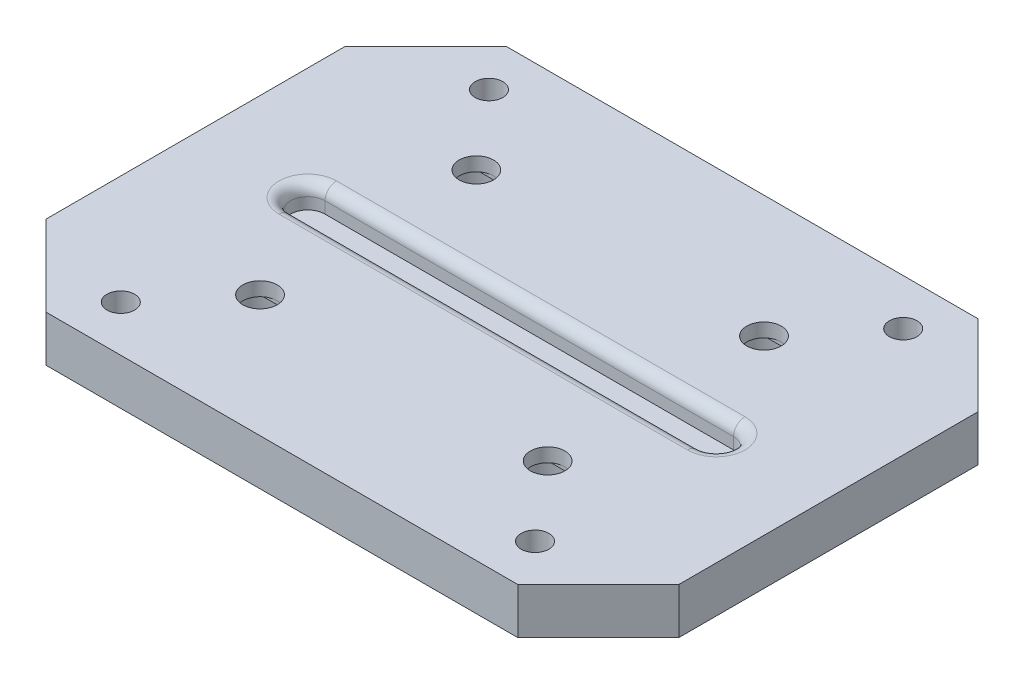
from build123d import *

# Parameters (mm, degrees)
SKETCH2_W           = 55
SKETCH2_H           = 40
SKETCH2_R           = 1.2
BOSS_EXTRUDE1_DEPTH = 4
CHAMFER1_SIZE       = 7
SKETCH3_R           = 1.5
CUT_EXTRUDE1_DEPTH  = 35.062442661
FILLET1_R           = 1
CUT_EXTRUDE2_START  = 0.5
SKETCH4_R           = 2.5
CUT_EXTRUDE2_DEPTH  = 35.562442661
CUT_EXTRUDE6_START  = 0.3
CUT_EXTRUDE6_DEPTH  = 0.3


with BuildPart() as part:
    # Sketch2 → Boss-Extrude1 (new body)
    with BuildSketch(Plane(origin=(0, 0, 0), x_dir=(1, 0, 0), z_dir=(0, 1, 0))):
        Rectangle(SKETCH2_W, SKETCH2_H)
        with Locations(Location((-18, -16, 0), (0, 0, 270))):
            Circle(SKETCH2_R, mode=Mode.SUBTRACT)
        with Locations(Location((18, -16, 0), (0, 0, 270))):
            Circle(SKETCH2_R, mode=Mode.SUBTRACT)
        with Locations(Location((-18, 16, 0), (0, 0, 270))):
            Circle(SKETCH2_R, mode=Mode.SUBTRACT)
        with Locations(Location((18, 16, 0), (0, 0, 270))):
            Circle(SKETCH2_R, mode=Mode.SUBTRACT)
    extrude(amount=-BOSS_EXTRUDE1_DEPTH)

    # Chamfer1
    chamfer1_edges = [part.edges().sort_by_distance(p)[0] for p in [
        (27.5, -2, 20),
        (-27.5, -2, 20),
        (-27.5, -2, -20),
        (27.5, -2, -20),
    ]]
    chamfer(chamfer1_edges, length=CHAMFER1_SIZE)

    # Sketch3 → Cut-Extrude1 (cut, through all)
    with BuildSketch(Plane(origin=(0, -2, 0), x_dir=(1, 0, 0), z_dir=(0, 1, 0))):
        with Locations(Location((12.5, 9.4, 0), (0, 0, 270))):
            Circle(SKETCH3_R)
        with Locations(Location((-12.5, 9.4, 0), (0, 0, 270))):
            Circle(SKETCH3_R)
        with Locations(Location((-12.5, -9.4, 0), (0, 0, 270))):
            Circle(SKETCH3_R)
        with Locations(Location((12.5, -9.4, 0), (0, 0, 270))):
            Circle(SKETCH3_R)
        with BuildLine():
            Line((17.75, 1.5), (-17.75, 1.5))
            ThreePointArc((-17.75, 1.5), (-19.25, 0), (-17.75, -1.5))
            Line((-17.75, -1.5), (17.75, -1.5))
            ThreePointArc((17.75, -1.5), (19.25, 0), (17.75, 1.5))
        make_face()
    extrude(amount=CUT_EXTRUDE1_DEPTH, mode=Mode.SUBTRACT)

    # Fillet1
    fillet1_edges = [part.edges().sort_by_distance(p)[0] for p in [
        (19.25, 0, 0),
        (0, 0, -1.5),
        (-19.25, 0, 0),
        (0, 0, 1.5),
    ]]
    fillet(fillet1_edges, radius=FILLET1_R)

    # Sketch4 → Cut-Extrude2 (cut, through all)
    with BuildSketch(Plane(origin=(0, -2, 0), x_dir=(1, 0, 0), z_dir=(0, 1, 0)).offset(CUT_EXTRUDE2_START)):
        with Locations(Location((-12.5, 9.4, 0), (0, 0, 270))):
            Circle(SKETCH4_R)
        with Locations(Location((12.5, 9.4, 0), (0, 0, 270))):
            Circle(SKETCH4_R)
        with Locations(Location((-12.5, -9.4, 0), (0, 0, 270))):
            Circle(SKETCH4_R)
        with Locations(Location((12.5, -9.4, 0), (0, 0, 270))):
            Circle(SKETCH4_R)
    extrude(amount=-CUT_EXTRUDE2_DEPTH, mode=Mode.SUBTRACT)

    # Sketch5 → Cut-Extrude6 (cut)
    with BuildSketch(Plane(origin=(0, -1.5, 0), x_dir=(1, 0, 0), z_dir=(0, 1, 0)).offset(CUT_EXTRUDE6_START)):
        with BuildLine():
            Line((-14.5, -10.9), (-10.5, -10.9))
            ThreePointArc((-10.5, -10.9), (-10, -9.4), (-10.5, -7.9))
            Line((-10.5, -7.9), (-14.5, -7.9))
            ThreePointArc((-14.5, -7.9), (-15, -9.4), (-14.5, -10.9))
        make_face()
        with BuildLine():
            Line((-14.5, 7.9), (-10.5, 7.9))
            ThreePointArc((-10.5, 7.9), (-10, 9.4), (-10.5, 10.9))
            Line((-10.5, 10.9), (-14.5, 10.9))
            ThreePointArc((-14.5, 10.9), (-15, 9.4), (-14.5, 7.9))
        make_face()
        with BuildLine():
            Line((10.5, -10.9), (14.5, -10.9))
            ThreePointArc((14.5, -10.9), (15, -9.4), (14.5, -7.9))
            Line((14.5, -7.9), (10.5, -7.9))
            ThreePointArc((10.5, -7.9), (10, -9.4), (10.5, -10.9))
        make_face()
        with BuildLine():
            Line((10.5, 7.9), (14.5, 7.9))
            ThreePointArc((14.5, 7.9), (15, 9.4), (14.5, 10.9))
            Line((14.5, 10.9), (10.5, 10.9))
            ThreePointArc((10.5, 10.9), (10, 9.4), (10.5, 7.9))
        make_face()
    extrude(amount=-CUT_EXTRUDE6_DEPTH, mode=Mode.SUBTRACT)


solid = part.part
